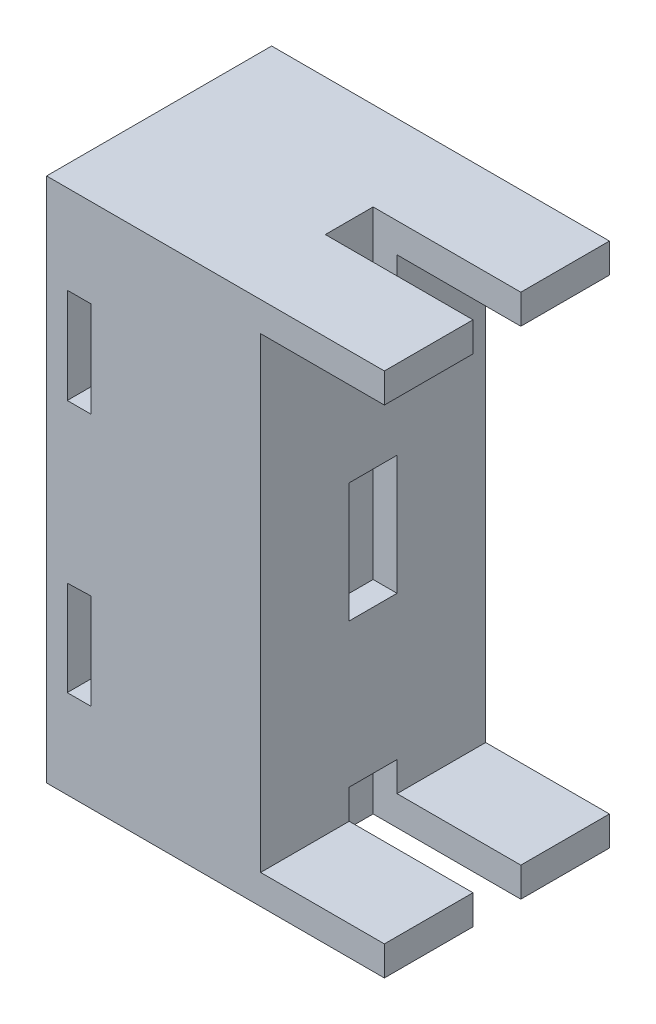
from build123d import *

# Parameters (mm, degrees)
SERVO_CLASPER_2ND_HALF_SERVO_A_DEPTH     = 7.62
VESTIGIAL_START                          = 7.62
CENTER_ENCAPSULATOR_W                    = 2.0574
CENTER_ENCAPSULATOR_H                    = 12.446
CENTER_ENCAPSULATOR_H_2                  = 12.377096657
VESTIGIAL_BUT_NICE_DEPTH                 = 4.1148
SERVO_START                              = 11.7348
SERVO_CLASPER_2ND_HALF_OTHER_SERVO_DEPTH = 7.62
SKETCH12_W                               = 19.3548
SKETCH12_H                               = 45.212
SERVO_HOLDER_EXTRUDE_DEPTH               = 16.350000066
SERVO_B_CUT_DEPTH                        = 7.62
SERVO_B_SECURER_CUT_DEPTH                = 49.176817947
SERVO_B_SECURER_CUT_DEPTH_BACK           = 49.176817947
SKETCH18_W                               = 2.032
SKETCH18_H                               = 8.21582812


with BuildPart() as part:
    # Sketch1 → Servo Clasper 2nd Half (Servo A) (new body)
    with BuildSketch(Plane.XY):
        Polygon((2.60310559, 35.312310559), (2.60310559, 32.772310559), (-8.03949441, 32.772310559), (-8.03949441, -7.359689441), (2.60310559, -7.359689441), (2.60310559, -9.899689441), (-10.09689441, -9.899689441), (-10.09689441, 35.312310559), align=None)
    extrude(amount=SERVO_CLASPER_2ND_HALF_SERVO_A_DEPTH)

    # center encapsulator → Vestigial but nice (add)
    with BuildSketch(Plane.XY.offset(VESTIGIAL_START)):
        with Locations((-9.06819441, 24.072810559)):
            Rectangle(CENTER_ENCAPSULATOR_W, CENTER_ENCAPSULATOR_H)
        with Locations((-9.06819441, 1.374262231)):
            Rectangle(CENTER_ENCAPSULATOR_W, CENTER_ENCAPSULATOR_H_2)
    extrude(amount=VESTIGIAL_BUT_NICE_DEPTH)

    # Sketch7 → Servo Clasper 2nd Half (Other Servo) (add)
    with BuildSketch(Plane.XY.offset(SERVO_START)):
        Polygon((2.60310559, 35.312310559), (2.60310559, 32.772310559), (-8.03949441, 32.772310559), (-8.03949441, -7.359689441), (2.60310559, -7.359689441), (2.60310559, -9.899689441), (-10.09689441, -9.899689441), (-10.09689441, 35.312310559), align=None)
    extrude(amount=SERVO_CLASPER_2ND_HALF_OTHER_SERVO_DEPTH)

    # Sketch12 → Servo Holder Extrude (add)
    with BuildSketch(Plane.ZY.offset(10.09689441)):
        with Locations((9.6774, 12.706310559)):
            Rectangle(SKETCH12_W, SKETCH12_H)
    extrude(amount=SERVO_HOLDER_EXTRUDE_DEPTH)

    # Sketch14 → Servo B Cut (cut)
    with BuildSketch(Plane.ZY.offset(26.446894476)):
        Polygon((7.29615, 29.470310559), (12.05865, 29.470310559), (14.1859, 14.687510559), (14.1859, 10.725110559), (12.05865, -4.057689441), (7.29615, -4.057689441), (5.1689, 10.725110559), (5.1689, 14.687510559), align=None)
    extrude(amount=-SERVO_B_CUT_DEPTH, mode=Mode.SUBTRACT)

    # Sketch18 → Servo B Securer Cut (cut, two sides: drawn at the far end of the back side and taken through both)
    with BuildSketch(Plane(origin=(0, 0, 0), x_dir=(-1, 0, 0), z_dir=(0, 0, -1)).offset(-SERVO_B_SECURER_CUT_DEPTH_BACK)):
        with Locations((23.652894476, 23.584396499)):
            Rectangle(SKETCH18_W, SKETCH18_H)
        Polygon((24.668894476, 5.874578093), (22.636894476, 5.936138467), (22.636894476, -2.279689441), (24.668894476, -2.279689441), align=None)
    extrude(amount=SERVO_B_SECURER_CUT_DEPTH + SERVO_B_SECURER_CUT_DEPTH_BACK, mode=Mode.SUBTRACT)


solid = part.part
